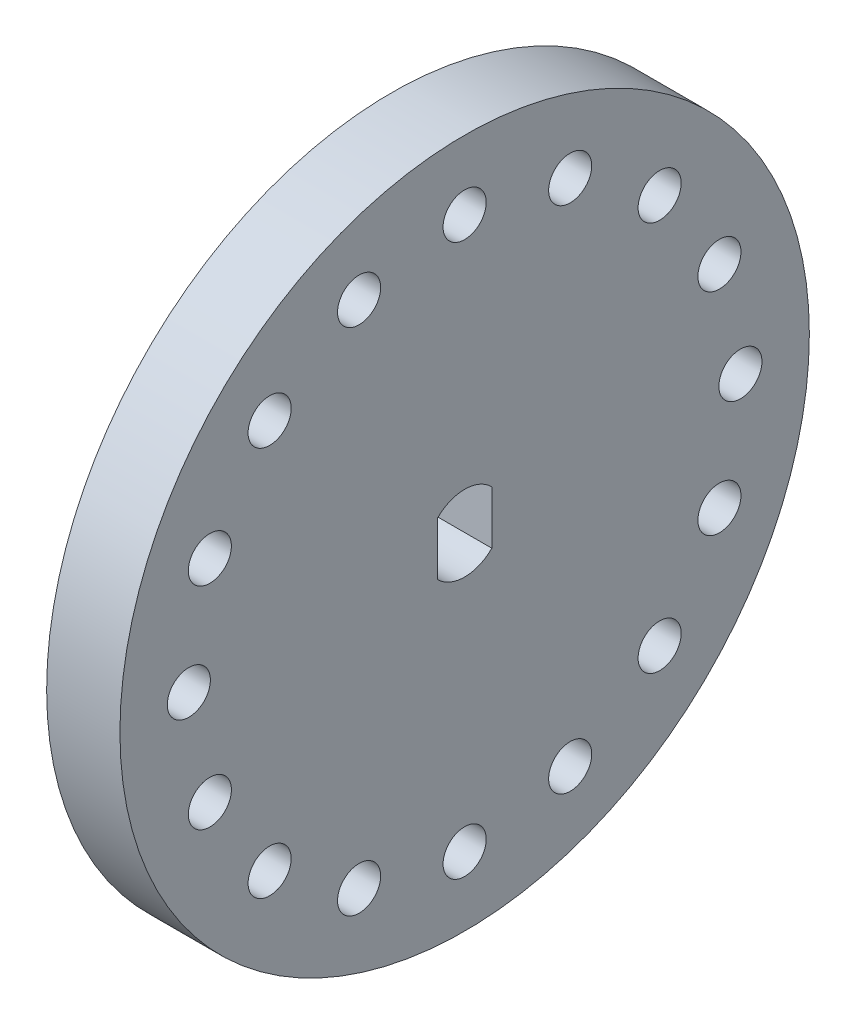
from build123d import *

# Parameters (mm, degrees)
SKETCH1_R   = 12.7
SKETCH1_R_2 = 0.79375
BASE_DEPTH  = 2.7


with BuildPart() as part:
    # Sketch1 → Base (new body)
    with BuildSketch(Plane(origin=(0, 0, 0), x_dir=(0, 0, -1), z_dir=(1, 0, 0))):
        with Locations(Location((0, 0, 0), (0, 0, 180))):
            Circle(SKETCH1_R)
        with Locations(Location((0, 10.16, 0), (0, 0, 180))):
            Circle(SKETCH1_R_2, mode=Mode.SUBTRACT)
        with Locations(Location((3.888063673, 9.38661605, 0), (0, 0, 180))):
            Circle(SKETCH1_R_2, mode=Mode.SUBTRACT)
        with Locations(Location((7.184204897, 7.184204897, 0), (0, 0, 180))):
            Circle(SKETCH1_R_2, mode=Mode.SUBTRACT)
        with Locations(Location((9.38661605, 3.888063673, 0), (0, 0, 180))):
            Circle(SKETCH1_R_2, mode=Mode.SUBTRACT)
        with Locations(Location((10.16, 0, 0), (0, 0, 180))):
            Circle(SKETCH1_R_2, mode=Mode.SUBTRACT)
        with Locations(Location((9.38661605, -3.888063673, 0), (0, 0, 180))):
            Circle(SKETCH1_R_2, mode=Mode.SUBTRACT)
        with Locations(Location((7.184204897, -7.184204897, 0), (0, 0, 180))):
            Circle(SKETCH1_R_2, mode=Mode.SUBTRACT)
        with Locations(Location((3.888063673, -9.38661605, 0), (0, 0, 180))):
            Circle(SKETCH1_R_2, mode=Mode.SUBTRACT)
        with Locations(Location((0, -10.16, 0), (0, 0, 180))):
            Circle(SKETCH1_R_2, mode=Mode.SUBTRACT)
        with Locations(Location((-3.888063673, -9.38661605, 0), (0, 0, 180))):
            Circle(SKETCH1_R_2, mode=Mode.SUBTRACT)
        with Locations(Location((-7.184204897, -7.184204897, 0), (0, 0, 180))):
            Circle(SKETCH1_R_2, mode=Mode.SUBTRACT)
        with Locations(Location((-9.38661605, -3.888063673, 0), (0, 0, 180))):
            Circle(SKETCH1_R_2, mode=Mode.SUBTRACT)
        with Locations(Location((-10.16, 0, 0), (0, 0, 180))):
            Circle(SKETCH1_R_2, mode=Mode.SUBTRACT)
        with Locations(Location((-9.38661605, 3.888063673, 0), (0, 0, 180))):
            Circle(SKETCH1_R_2, mode=Mode.SUBTRACT)
        with Locations(Location((-7.184204897, 7.184204897, 0), (0, 0, 180))):
            Circle(SKETCH1_R_2, mode=Mode.SUBTRACT)
        with Locations(Location((-3.888063673, 9.38661605, 0), (0, 0, 180))):
            Circle(SKETCH1_R_2, mode=Mode.SUBTRACT)
        with BuildLine():
            Line((1, 0.979795897), (1, -0.979795897))
            ThreePointArc((1, -0.979795897), (0, -1.4), (-1, -0.979795897))
            Line((-1, -0.979795897), (-1, 0.979795897))
            ThreePointArc((-1, 0.979795897), (0, 1.4), (1, 0.979795897))
        make_face(mode=Mode.SUBTRACT)
    extrude(amount=BASE_DEPTH)


solid = part.part
